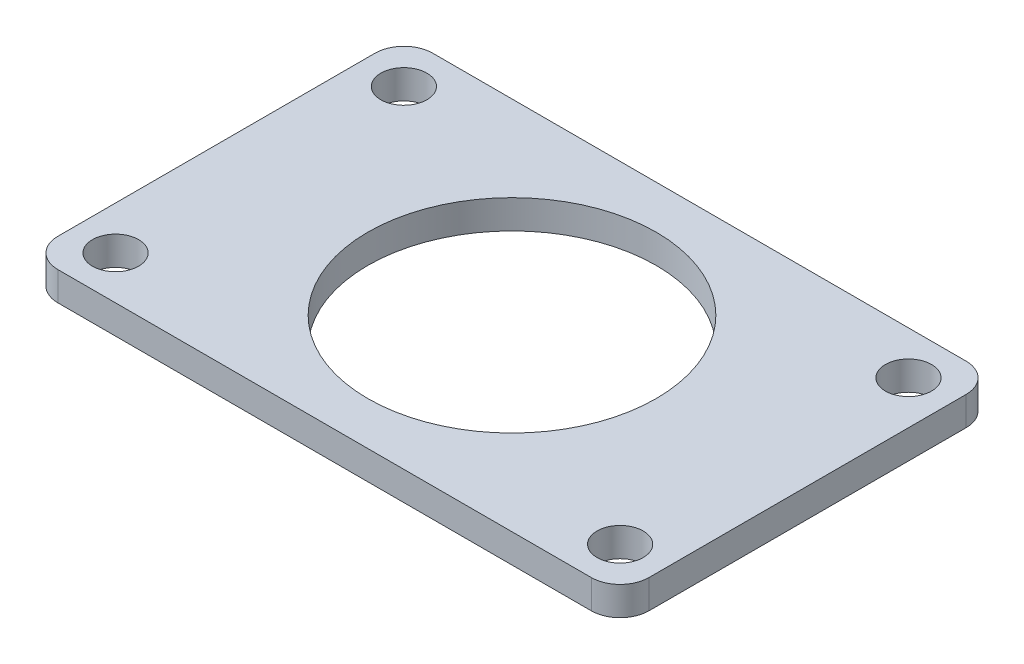
from build123d import *

# Parameters (mm, degrees)
SKETCH_1_W      = 41
SKETCH_1_H      = 26
SKETCH_1_R      = 1.6
SKETCH_1_R_2    = 10
EXTRUDE_1_DEPTH = 2
FILLET_1_R      = 2


with BuildPart() as part:
    # 草图1 → 凸台-拉伸1 (new body)
    with BuildSketch(Plane(origin=(0, 0, 0), x_dir=(1, 0, 0), z_dir=(0, 1, 0))):
        Rectangle(SKETCH_1_W, SKETCH_1_H)
        with Locations(Location((-17.5, 10, 0), (0, 0, 270))):
            Circle(SKETCH_1_R, mode=Mode.SUBTRACT)
        with Locations(Location((17.5, 10, 0), (0, 0, 270))):
            Circle(SKETCH_1_R, mode=Mode.SUBTRACT)
        with Locations(Location((17.5, -10, 0), (0, 0, 270))):
            Circle(SKETCH_1_R, mode=Mode.SUBTRACT)
        with Locations(Location((-17.5, -10, 0), (0, 0, 270))):
            Circle(SKETCH_1_R, mode=Mode.SUBTRACT)
        with Locations(Location((0, 0, 0), (0, 0, 270))):
            Circle(SKETCH_1_R_2, mode=Mode.SUBTRACT)
    extrude(amount=EXTRUDE_1_DEPTH)

    # 圆角1
    fillet_1_edges = [part.edges().sort_by_distance(p)[0] for p in [
        (-20.5, 1, -13),
        (20.5, 1, -13),
        (20.5, 1, 13),
        (-20.5, 1, 13),
    ]]
    fillet(fillet_1_edges, radius=FILLET_1_R)


solid = part.part
